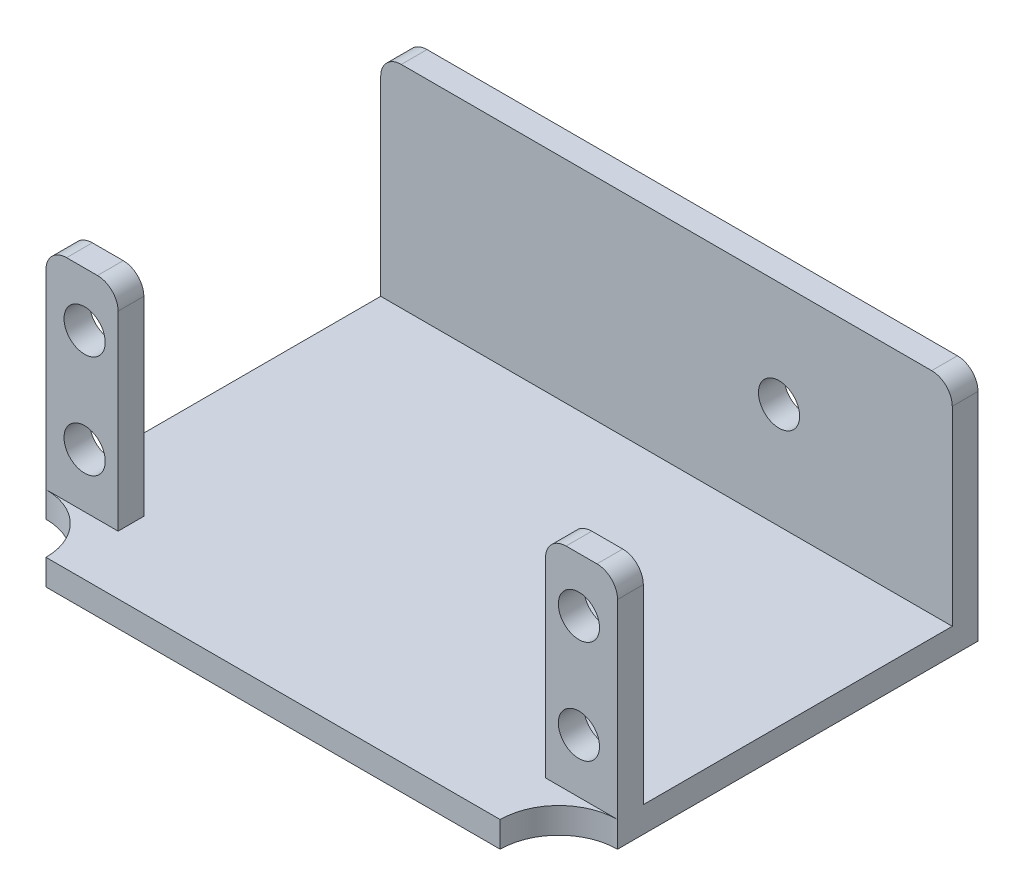
from build123d import *

# Parameters (mm, degrees)
SKETCH1_W                   = 55.5
SKETCH1_H                   = 38.2
BRACKETBASE_DEPTH           = 2.5
SKETCH2_W                   = 7
SKETCH2_H                   = 20.5
SERVOMOUNTINGHOLETABS_DEPTH = 2.5
SKETCH3_R                   = 2
SERVOMOUNTINGHOLES_DEPTH    = 2.5
SKETCH4_W                   = 55.5
SKETCH4_H                   = 2.5
BASEWALL_DEPTH              = 23
SKETCH6_R                   = 5.7
BASETRIM_DEPTH              = 2.5
FILLET1_R                   = 2
SKETCH7_R                   = 2
M4MOUNTINGHOLE_DEPTH        = 10
SKETCH8_R                   = 2
CUT_EXTRUDE1_DEPTH          = 10
SKETCH9_R                   = 2
BOSS_EXTRUDE1_DEPTH         = 2.5


with BuildPart() as part:
    # Sketch1 → bracketBase (new body)
    with BuildSketch(Plane(origin=(0, 0, 0), x_dir=(1, 0, 0), z_dir=(0, 1, 0))):
        with Locations((27.75, 19.1)):
            Rectangle(SKETCH1_W, SKETCH1_H)
    extrude(amount=BRACKETBASE_DEPTH)

    # Sketch2 → servoMountingHoleTabs (add)
    with BuildSketch(Plane.XY.offset(-8.2)):
        with Locations((3.5, 12.75)):
            Rectangle(SKETCH2_W, SKETCH2_H)
        with Locations((52, 12.75)):
            Rectangle(SKETCH2_W, SKETCH2_H)
    extrude(amount=SERVOMOUNTINGHOLETABS_DEPTH)

    # Sketch3 → servoMountingHoles (cut)
    with BuildSketch(Plane.XY.offset(-5.7)):
        with Locations((3.75, 17.75)):
            Circle(SKETCH3_R)
        with Locations(Location((3.75, 7.75, 0), (0, 0, 180))):
            Circle(SKETCH3_R)
        with Locations((51.75, 7.75)):
            Circle(SKETCH3_R)
        with Locations(Location((51.75, 17.75, 0), (0, 0, 180))):
            Circle(SKETCH3_R)
    extrude(amount=-SERVOMOUNTINGHOLES_DEPTH, mode=Mode.SUBTRACT)

    # Sketch4 → baseWall (add)
    with BuildSketch(Plane(origin=(0, 0, 0), x_dir=(1, 0, 0), z_dir=(0, 1, 0))):
        with Locations((27.75, 39.45)):
            Rectangle(SKETCH4_W, SKETCH4_H)
    extrude(amount=BASEWALL_DEPTH)

    # Sketch6 → baseTrim (cut)
    with BuildSketch(Plane(origin=(0, 2.5, 0), x_dir=(1, 0, 0), z_dir=(0, 1, 0))):
        Circle(SKETCH6_R)
        with Locations((55.5, 0)):
            Circle(SKETCH6_R)
    extrude(amount=-BASETRIM_DEPTH, mode=Mode.SUBTRACT)

    # Fillet1
    fillet1_edges = [part.edges().sort_by_distance(p)[0] for p in [
        (0, 23, -6.95),
        (7, 23, -6.95),
        (55.5, 23, -6.95),
        (48.5, 23, -6.95),
        (55.5, 23, -39.45),
        (0, 23, -39.45),
    ]]
    fillet(fillet1_edges, radius=FILLET1_R)

    # Sketch7 → M4mountingHole (cut)
    with BuildSketch(Plane(origin=(0, 0, -40.7), x_dir=(-1, 0, 0), z_dir=(0, 0, -1))):
        with Locations((-16.81899151, 12.75)):
            Circle(SKETCH7_R)
    extrude(amount=-M4MOUNTINGHOLE_DEPTH, mode=Mode.SUBTRACT)

    # Sketch8 → Cut-Extrude1 (cut)
    with BuildSketch(Plane(origin=(0, 0, -40.7), x_dir=(-1, 0, 0), z_dir=(0, 0, -1))):
        with Locations((-38.68100849, 12.75)):
            Circle(SKETCH8_R)
    extrude(amount=-CUT_EXTRUDE1_DEPTH, mode=Mode.SUBTRACT)

    # Sketch9 → Boss-Extrude1 (add)
    with BuildSketch(Plane(origin=(0, 0, -40.7), x_dir=(-1, 0, 0), z_dir=(0, 0, -1))):
        with Locations((-16.81899151, 12.75)):
            Circle(SKETCH9_R)
    extrude(amount=-BOSS_EXTRUDE1_DEPTH)


solid = part.part
